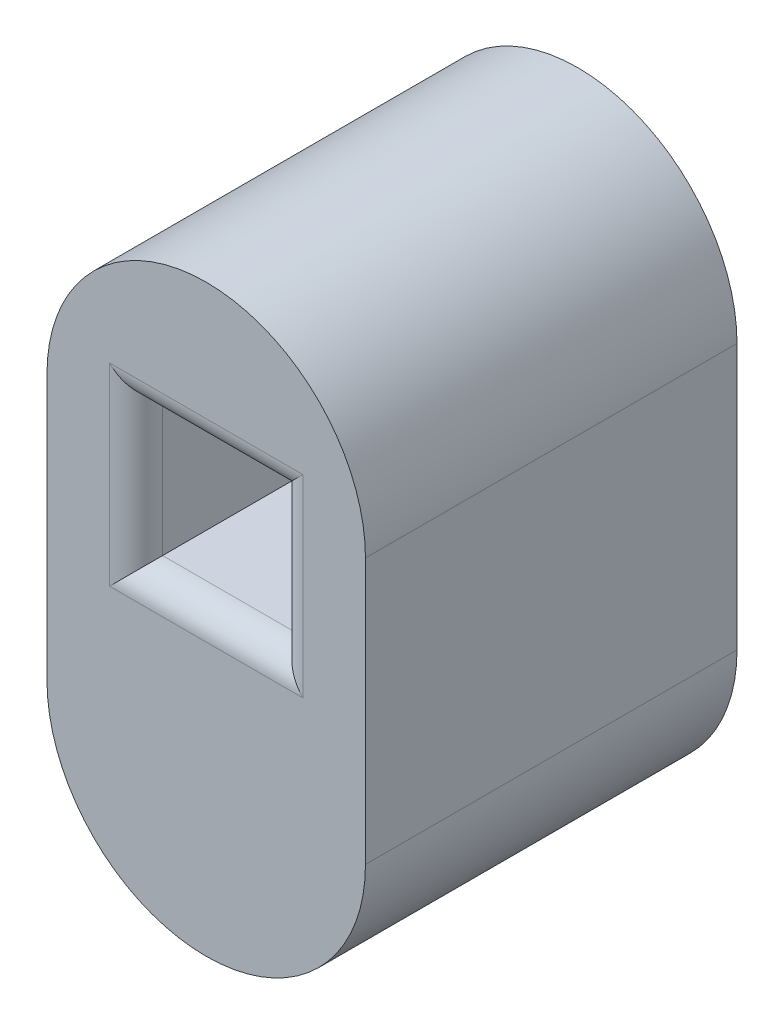
from build123d import *

# Parameters (mm, degrees)
SKETCH1_W           = 5.288
SKETCH1_H           = 5.288
BOSS_EXTRUDE1_DEPTH = 14
FILLET1_R           = 1
FILLET2_R           = 1


with BuildPart() as part:
    # Sketch1 → Boss-Extrude1 (new body)
    with BuildSketch(Plane.XY):
        with BuildLine():
            Line((-6, 0), (-6, 10))
            ThreePointArc((-6, 10), (0, 16), (6, 10))
            Line((6, 10), (6, 0))
            ThreePointArc((6, 0), (0, -6), (-6, 0))
        make_face()
        with Locations((0, 7.9)):
            Rectangle(SKETCH1_W, SKETCH1_H, mode=Mode.SUBTRACT)
    extrude(amount=BOSS_EXTRUDE1_DEPTH)

    # Fillet1
    fillet1_edges = [part.edges().sort_by_distance(p)[0] for p in [
        (2.644, 7.9, 14),
        (0, 10.544, 14),
        (-2.644, 7.9, 14),
        (0, 5.256, 14),
    ]]
    fillet(fillet1_edges, radius=FILLET1_R)

    # Fillet2
    fillet2_edges = [part.edges().sort_by_distance(p)[0] for p in [
        (2.644, 7.9, 0),
        (0, 10.544, 0),
        (-2.644, 7.9, 0),
        (0, 5.256, 0),
    ]]
    fillet(fillet2_edges, radius=FILLET2_R)


solid = part.part
